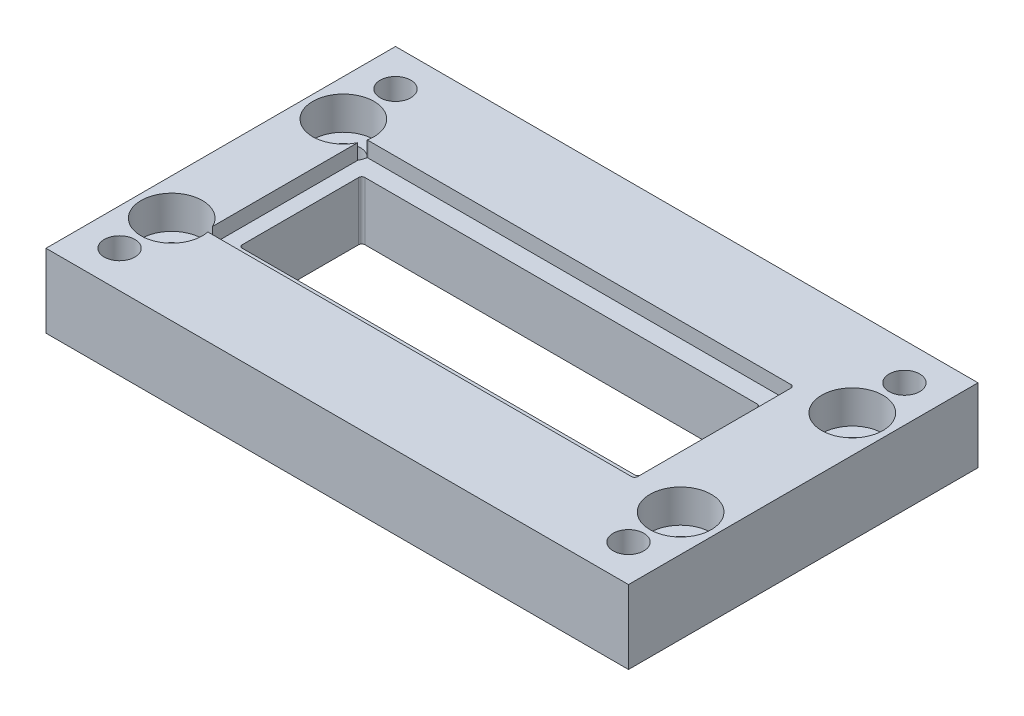
from build123d import *

# Parameters (mm, degrees)
SKETCH1_W                                   = 95
SKETCH1_H                                   = 57
SKETCH1_R                                   = 2.057983022
BOSS_EXTRUDE2_DEPTH                         = 12
BOSS_EXTRUDE3_DEPTH                         = 9.5
CBORE_FOR_M6_CHEESE_HEAD_SCREW1_D           = 5.5
CBORE_FOR_M6_CHEESE_HEAD_SCREW1_CBORE_D     = 10
CBORE_FOR_M6_CHEESE_HEAD_SCREW1_CBORE_DEPTH = 5.4
F_5_0_5_DIAMETER_HOLE1_D                    = 5


with BuildPart() as part:
    # Sketch1 → Boss-Extrude2 (new body)
    with BuildSketch(Plane(origin=(0, 0, 0), x_dir=(1, 0, 0), z_dir=(0, 1, 0))):
        Rectangle(SKETCH1_W, SKETCH1_H)
        with Locations((-41.5, -22.5)):
            Circle(SKETCH1_R, mode=Mode.SUBTRACT)
        with Locations((41.5, -22.5)):
            Circle(SKETCH1_R, mode=Mode.SUBTRACT)
        with BuildLine():
            Line((-36.5, 13), (32.5, 13))
            ThreePointArc((32.5, 13), (32.853553391, 12.853553391), (33, 12.5))
            Line((33, 12.5), (33, -12.5))
            ThreePointArc((33, -12.5), (32.853553391, -12.853553391), (32.5, -13))
            Line((32.5, -13), (-36.5, -13))
            ThreePointArc((-36.5, -13), (-36.853553391, -12.853553391), (-37, -12.5))
            Line((-37, -12.5), (-37, 12.5))
            ThreePointArc((-37, 12.5), (-36.853553391, 12.853553391), (-36.5, 13))
        make_face(mode=Mode.SUBTRACT)
        with Locations((-41.5, 22.5)):
            Circle(SKETCH1_R, mode=Mode.SUBTRACT)
        with Locations((41.5, 22.5)):
            Circle(SKETCH1_R, mode=Mode.SUBTRACT)
    extrude(amount=BOSS_EXTRUDE2_DEPTH)

    # Sketch1<5> → Boss-Extrude3 (add)
    with BuildSketch(Plane(origin=(0, 0, 0), x_dir=(1, 0, 0), z_dir=(0, 1, 0))):
        with BuildLine():
            ThreePointArc((33, 12.5), (32.853553391, 12.853553391), (32.5, 13))
            Line((32.5, 13), (-36.5, 13))
            ThreePointArc((-36.5, 13), (-36.853553391, 12.853553391), (-37, 12.5))
            Line((-37, 12.5), (-37, -12.5))
            ThreePointArc((-37, -12.5), (-36.853553391, -12.853553391), (-36.5, -13))
            Line((-36.5, -13), (32.5, -13))
            ThreePointArc((32.5, -13), (32.853553391, -12.853553391), (33, -12.5))
            Line((33, -12.5), (33, 12.5))
        make_face()
        with BuildLine():
            ThreePointArc((30.5, -9.5), (30.353553391, -9.853553391), (30, -10))
            Line((30, -10), (-34, -10))
            ThreePointArc((-34, -10), (-34.353553391, -9.853553391), (-34.5, -9.5))
            Line((-34.5, -9.5), (-34.5, 9.5))
            ThreePointArc((-34.5, 9.5), (-34.353553391, 9.853553391), (-34, 10))
            Line((-34, 10), (30, 10))
            ThreePointArc((30, 10), (30.353553391, 9.853553391), (30.5, 9.5))
            Line((30.5, 9.5), (30.5, -9.5))
        make_face(mode=Mode.SUBTRACT)
    extrude(amount=BOSS_EXTRUDE3_DEPTH)

    # CBORE for M6 Cheese Head Screw1 (through all)
    with Locations(Plane(origin=(-41.5, 12, -14), x_dir=(0, 0, 1), z_dir=(0, 1, 0))):
        with Locations((0, 0), (0, 83), (28, 83), (28, 0)):
            CounterBoreHole(CBORE_FOR_M6_CHEESE_HEAD_SCREW1_D / 2, CBORE_FOR_M6_CHEESE_HEAD_SCREW1_CBORE_D / 2, CBORE_FOR_M6_CHEESE_HEAD_SCREW1_CBORE_DEPTH)

    # Ø5.0 (5) Diameter Hole1 (through all)
    with Locations(Plane(origin=(-41.5, 12, -22.5), x_dir=(0, 0, 1), z_dir=(0, 1, 0))):
        with Locations((0, 0), (0, 83), (45, 83), (45, 0)):
            Hole(F_5_0_5_DIAMETER_HOLE1_D / 2)


solid = part.part
